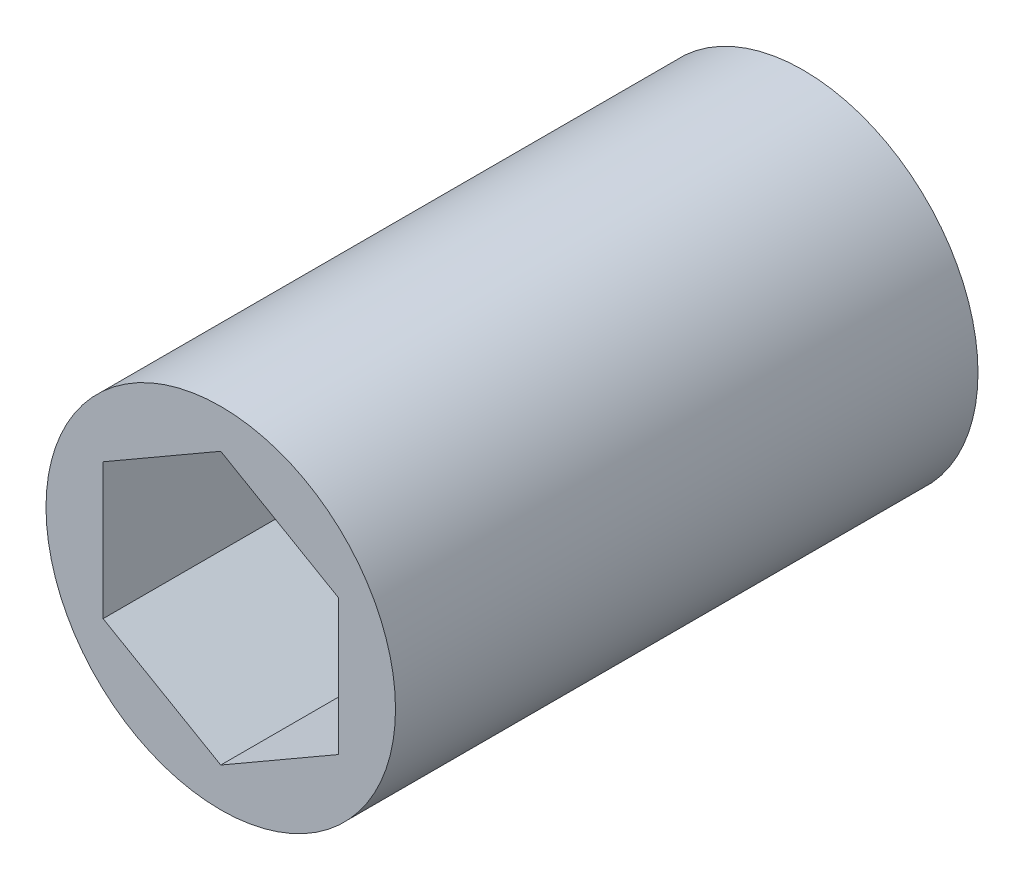
from build123d import *

# Parameters (mm, degrees)
SKETCH2_R           = 9.525
BOSS_EXTRUDE1_DEPTH = 31.75


with BuildPart() as part:
    # Sketch2 → Boss-Extrude1 (new body)
    with BuildSketch(Plane.XY):
        Circle(SKETCH2_R)
        Polygon((6.4135, 3.702835951), (0, 7.405671903), (-6.4135, 3.702835951), (-6.4135, -3.702835951), (0, -7.405671903), (6.4135, -3.702835951), align=None, mode=Mode.SUBTRACT)
    extrude(amount=BOSS_EXTRUDE1_DEPTH)


solid = part.part
